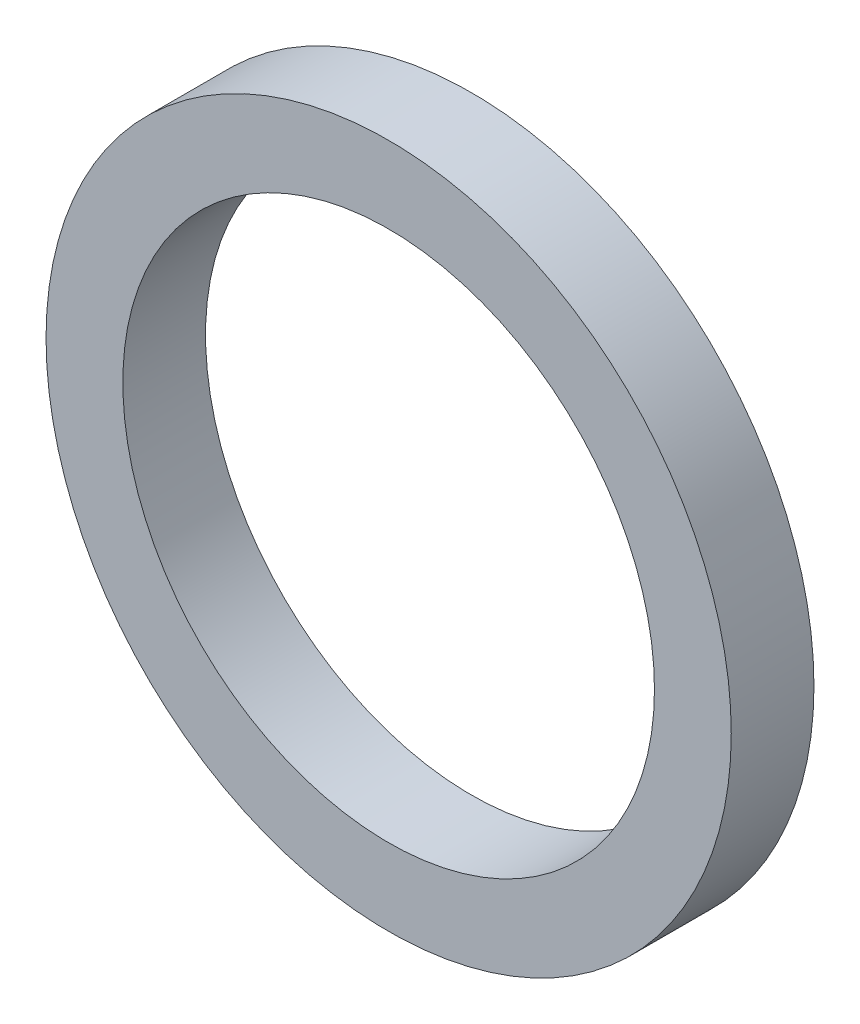
from build123d import *

# Parameters (mm, degrees)
SKETCH_1_R      = 29
SKETCH_1_R_2    = 22.5
EXTRUDE_1_DEPTH = 7


with BuildPart() as part:
    # 草图1 → 拉伸-薄壁1 (new body)
    with BuildSketch(Plane.XY):
        Circle(SKETCH_1_R)
        Circle(SKETCH_1_R_2, mode=Mode.SUBTRACT)
    extrude(amount=EXTRUDE_1_DEPTH)


solid = part.part
